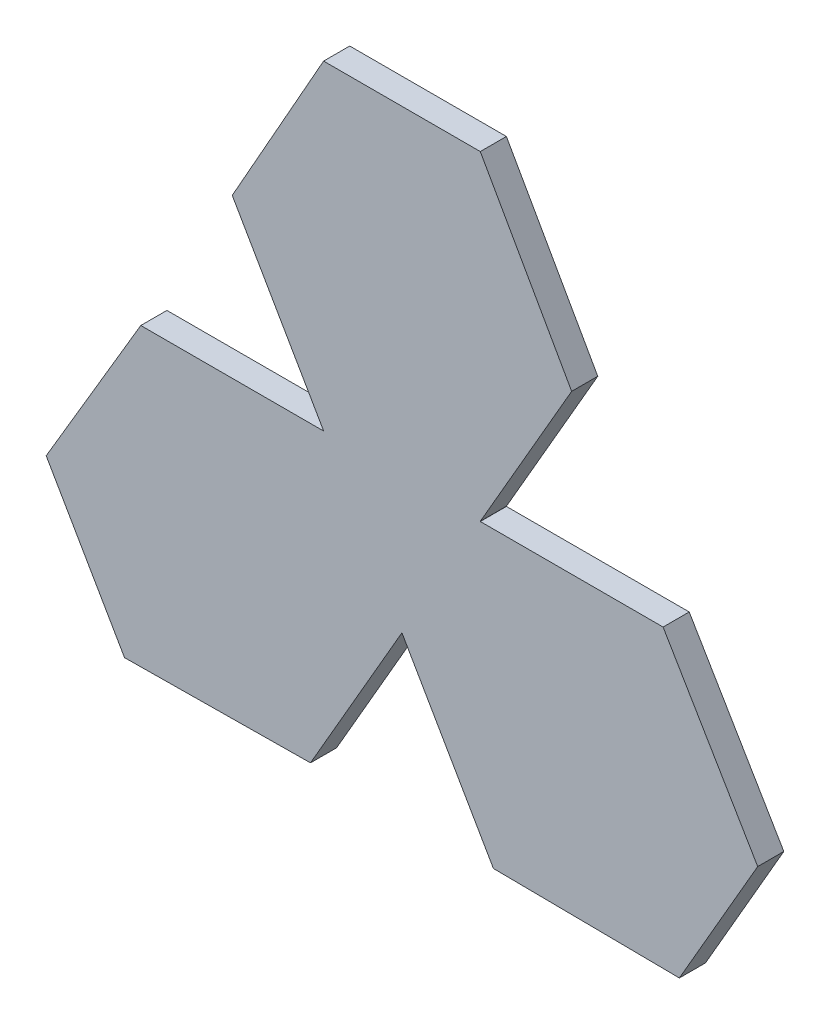
from build123d import *

# Parameters (mm, degrees)
BOSS_EXTRUDE1_DEPTH = 5


with BuildPart() as part:
    # Sketch1 → Boss-Extrude1 (new body)
    with BuildSketch(Plane.XY):
        Polygon((-32.495, 38.979803424), (-15, 70), (15, 70), (32.495, 38.979803424), (14.995, 8.668914292), (15, 8.660254038), (15.005, 8.651593784), (50.005, 8.651593784), (68.121778265, -22.009618943), (53.121778265, -47.990381057), (17.51, -47.631397208), (0.01, -17.320508076), (0, -17.320508076), (-0.01, -17.320508076), (-17.51, -47.631397208), (-53.121778265, -47.990381057), (-68.121778265, -22.009618943), (-50.005, 8.651593784), (-15.005, 8.651593784), (-15, 8.660254038), (-14.995, 8.668914292), align=None)
    extrude(amount=BOSS_EXTRUDE1_DEPTH)


solid = part.part
